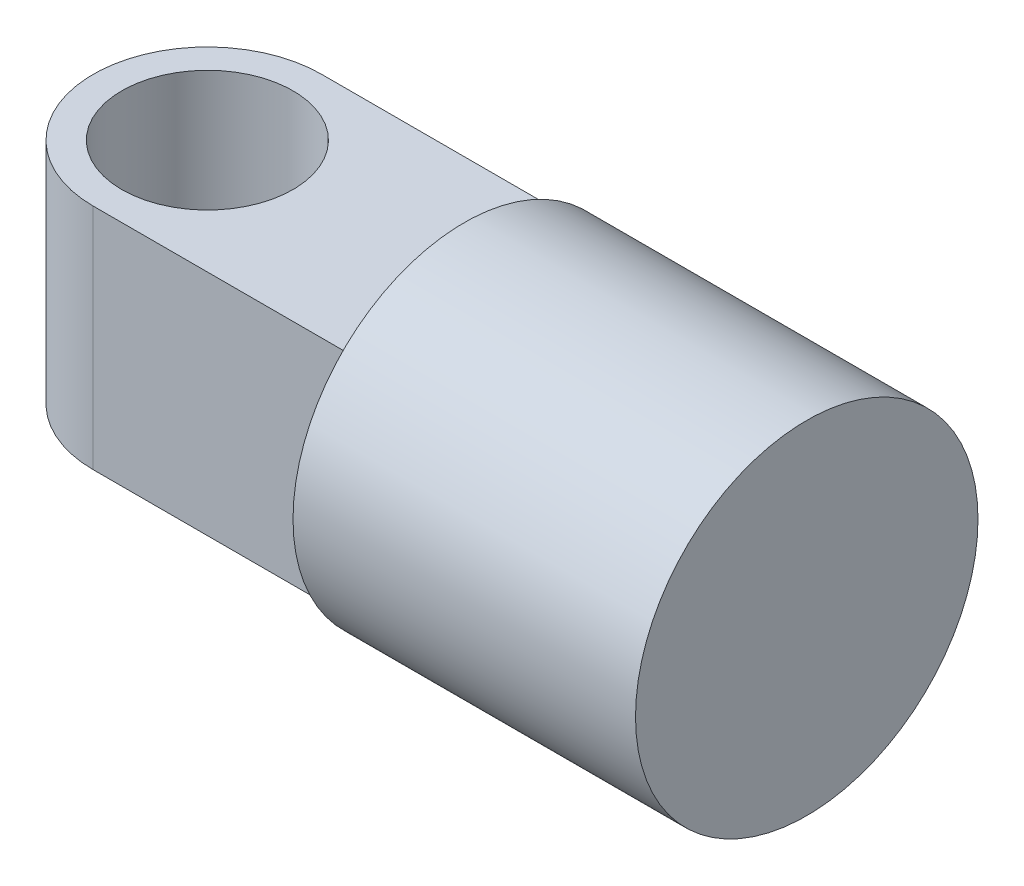
from build123d import *

# Parameters (mm, degrees)
SKETCH1_R           = 25.4
SKETCH1_R_2         = 19.05
BOSS_EXTRUDE1_DEPTH = 50.8
SKETCH2_R           = 38.1
BOSS_EXTRUDE2_DEPTH = 76.2


with BuildPart() as part:
    # Sketch1 → Boss-Extrude1 (new body)
    # profile 1 of 2: a face of its own
    with BuildSketch(Plane(origin=(0, 0, 0), x_dir=(1, 0, 0), z_dir=(0, 1, 0))):
        with BuildLine():
            ThreePointArc((25.4, 0), (17.960512242, -17.960512242), (0, -25.4))
            Line((0, -25.4), (57.15, -25.4))
            Line((57.15, -25.4), (57.15, 25.4))
            Line((57.15, 25.4), (0, 25.4))
            ThreePointArc((0, 25.4), (17.960512242, 17.960512242), (25.4, 0))
        make_face()
    # profile 2 of 2: a face of its own
    with BuildSketch(Plane(origin=(0, 0, 0), x_dir=(1, 0, 0), z_dir=(0, 1, 0))):
        Circle(SKETCH1_R)
        with Locations(Location((0, 0, 0), (0, 0, 270))):
            Circle(SKETCH1_R_2, mode=Mode.SUBTRACT)
    extrude(amount=BOSS_EXTRUDE1_DEPTH)

    # Sketch2 → Boss-Extrude2 (add)
    with BuildSketch(Plane(origin=(57.15, 0, 0), x_dir=(0, 0, -1), z_dir=(1, 0, 0))):
        with Locations(Location((0, 25.4, 0), (0, 0, 180))):
            Circle(SKETCH2_R)
    extrude(amount=BOSS_EXTRUDE2_DEPTH)


solid = part.part
